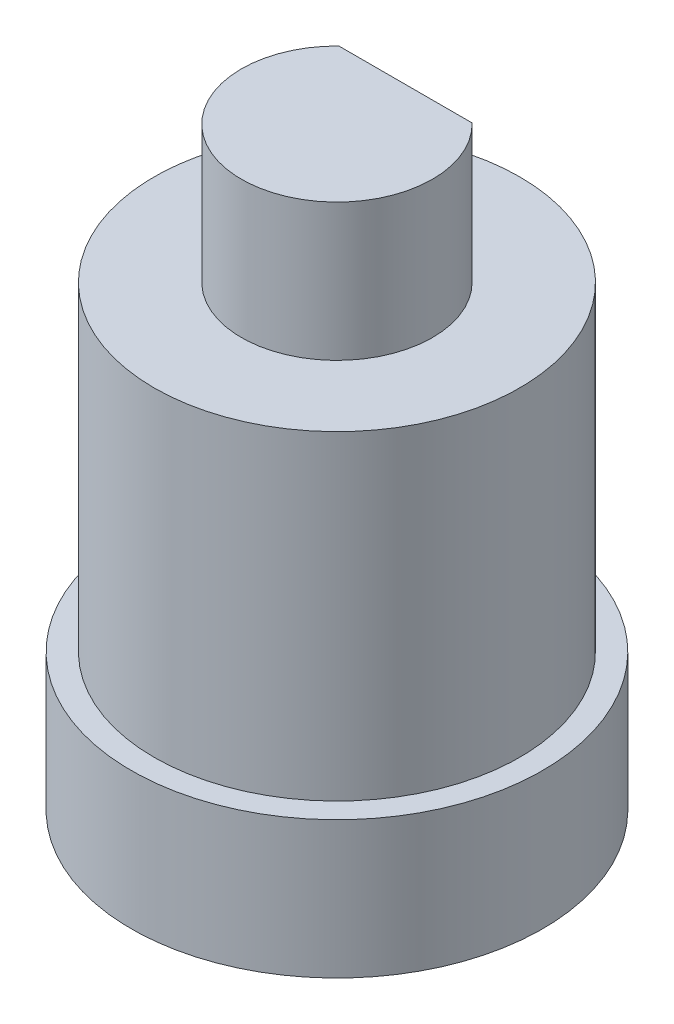
from build123d import *

# Parameters (mm, degrees)
SKETCH1_R           = 4
BOSS_EXTRUDE1_DEPTH = 10
BOSS_EXTRUDE2_DEPTH = 3
SKETCH3_R           = 4.5
SKETCH3_R_2         = 4
BOSS_EXTRUDE3_DEPTH = 3


with BuildPart() as part:
    # Sketch1 → Boss-Extrude1 (new body)
    with BuildSketch(Plane(origin=(0, 0, 0), x_dir=(1, 0, 0), z_dir=(0, 1, 0))):
        with Locations(Location((0, 0, 0), (0, 0, 270))):
            Circle(SKETCH1_R)
    extrude(amount=BOSS_EXTRUDE1_DEPTH)

    # Sketch2 → Boss-Extrude2 (add)
    with BuildSketch(Plane(origin=(0, 10, 0), x_dir=(1, 0, 0), z_dir=(0, 1, 0))):
        with BuildLine():
            Line((1.457625029, 1.5), (-1.457625029, 1.5))
            ThreePointArc((-1.457625029, 1.5), (-0.814230917, -1.926576949), (2.091571353, 0))
            ThreePointArc((2.091571353, 0), (1.926576949, 0.814230917), (1.457625029, 1.5))
        make_face()
    extrude(amount=BOSS_EXTRUDE2_DEPTH)

    # Sketch3 → Boss-Extrude3 (add)
    with BuildSketch(Plane.XZ):
        with Locations(Location((0, 0, 0), (0, 0, 270))):
            Circle(SKETCH3_R)
        with Locations(Location((0, 0, 0), (0, 0, 270))):
            Circle(SKETCH3_R_2, mode=Mode.SUBTRACT)
    extrude(amount=-BOSS_EXTRUDE3_DEPTH)


solid = part.part
